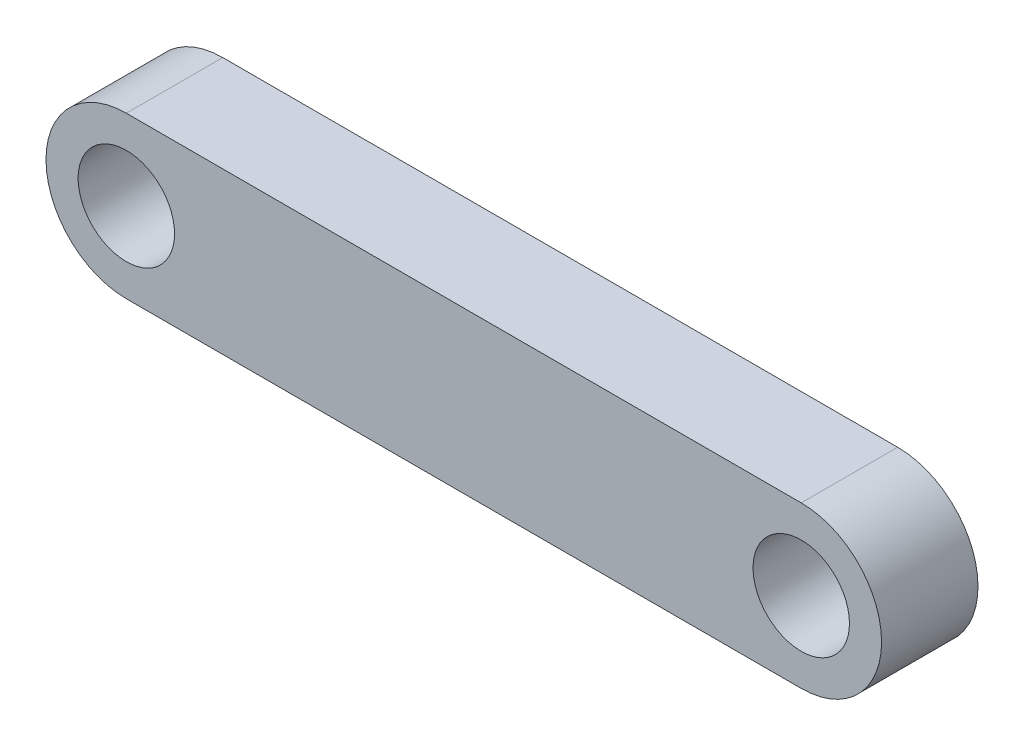
from build123d import *

# Parameters (mm, degrees)
SKETCH1_R           = 1.5
BOSS_EXTRUDE1_DEPTH = 3


with BuildPart() as part:
    # Sketch1 → Boss-Extrude1 (new body)
    with BuildSketch(Plane.XY):
        with BuildLine():
            Line((0, 0), (21, 0))
            ThreePointArc((21, 0), (23.5, 2.5), (21, 5))
            Line((21, 5), (0, 5))
            ThreePointArc((0, 5), (-2.5, 2.5), (0, 0))
        make_face()
        with Locations((0, 2.5)):
            Circle(SKETCH1_R, mode=Mode.SUBTRACT)
        with Locations((21, 2.5)):
            Circle(SKETCH1_R, mode=Mode.SUBTRACT)
    extrude(amount=BOSS_EXTRUDE1_DEPTH)


solid = part.part
